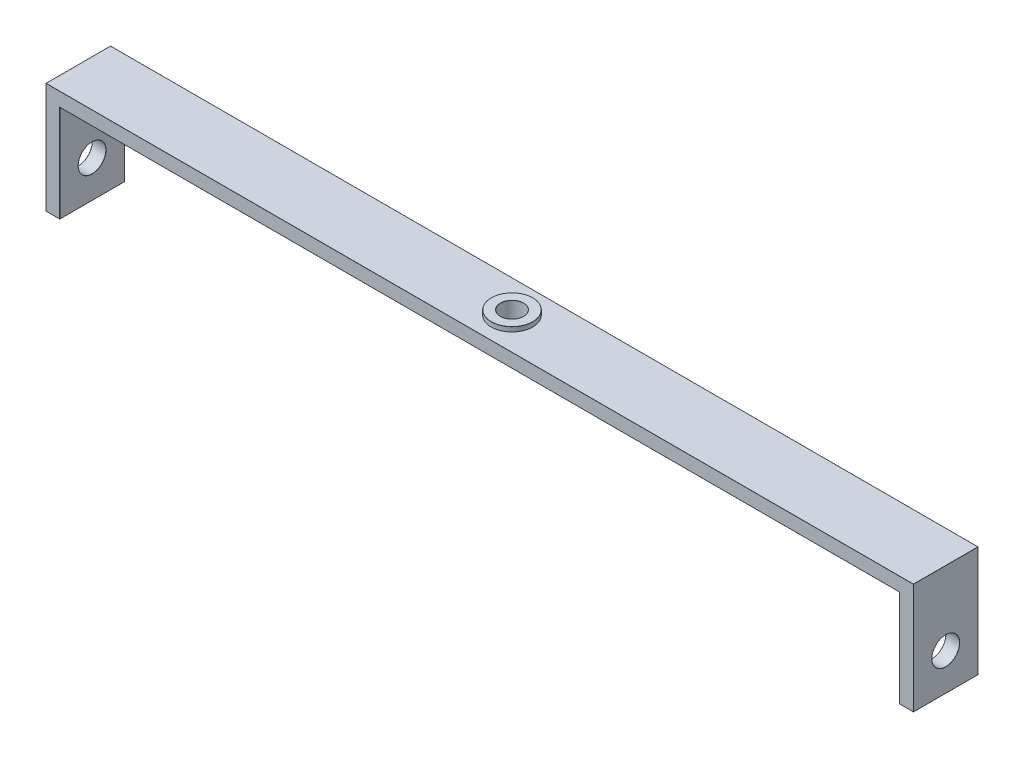
from build123d import *

# Parameters (mm, degrees)
BOSS_EXTRUDE1_DEPTH            = 3.5
BOSS_EXTRUDE1_DEPTH_BACK       = 3.5
SKETCH3_R                      = 1.25
CUT_EXTRUDE5_DEPTH             = 3.5
BOSS_EXTRUDE2_START            = 0.5
SKETCH5_R                      = 2.25
SKETCH5_R_2                    = 1.25
BOSS_EXTRUDE2_DEPTH            = 0.5
CUT_EXTRUDE6_REACH             = 72.102
SKETCH6_R                      = 1.5
CUT_EXTRUDE6_DIRECTION_2_REACH = 72.102
FILLET1_R                      = 0.01


with BuildPart() as part:
    # Sketch1 → Boss-Extrude1 (new, two sides: drawn at the far end of the back side and taken through both)
    with BuildSketch(Plane.XY.offset(-BOSS_EXTRUDE1_DEPTH_BACK)):
        Polygon((-62.621366216, 18.813688138), (-62.621366216, 30.813688138), (31.378633784, 30.813688138), (31.378633784, 18.813688138), (29.878633784, 18.813688138), (29.878633784, 29.313688138), (-61.121366216, 29.313688138), (-61.121366216, 18.813688138), align=None)
    extrude(amount=BOSS_EXTRUDE1_DEPTH + BOSS_EXTRUDE1_DEPTH_BACK)

    # Sketch3 → Cut-Extrude5 (cut)
    with BuildSketch(Plane(origin=(0, 30.813688138, 0), x_dir=(1, 0, 0), z_dir=(0, 1, 0))):
        with Locations((-15.621366216, 0)):
            Circle(SKETCH3_R)
    extrude(amount=-CUT_EXTRUDE5_DEPTH, mode=Mode.SUBTRACT)

    # Sketch5 → Boss-Extrude2 (add)
    with BuildSketch(Plane(origin=(0, 30.813688138, 0), x_dir=(1, 0, 0), z_dir=(0, 1, 0)).offset(BOSS_EXTRUDE2_START)):
        with Locations((-15.621366216, 0)):
            Circle(SKETCH5_R)
        with Locations((-15.621366216, 0)):
            Circle(SKETCH5_R_2, mode=Mode.SUBTRACT)
    extrude(amount=-BOSS_EXTRUDE2_DEPTH)

    # Cut-Extrude6: up to this face of the body (flat: up to its plane)
    cut_extrude6_end = Plane(part.part.faces().sort_by_distance((31.378633784, 24.813688138, 0))[0])
    # Sketch6 → Cut-Extrude6 (cut, up to the picked face)
    with BuildSketch(Plane(origin=(0, 0, 0), x_dir=(0, 0, -1), z_dir=(1, 0, 0)), mode=Mode.PRIVATE) as cut_extrude6_sk1:
        with Locations((0, 22.813688138)):
            Circle(SKETCH6_R)
    cut_extrude6_tool1 = split(extrude(cut_extrude6_sk1.sketch, amount=CUT_EXTRUDE6_REACH, mode=Mode.PRIVATE), bisect_by=cut_extrude6_end, keep=Keep.BOTH, mode=Mode.PRIVATE)
    add(cut_extrude6_tool1.solids().sort_by(Axis((0, 22.813688, 0), (1, 0, 0)))[0], mode=Mode.SUBTRACT)

    # Cut-Extrude6 direction 2: up to this face of the body (flat: up to its plane)
    cut_extrude6_direction_2_end = Plane(part.part.faces().sort_by_distance((-62.621366216, 24.813688138, 0))[0])
    # Sketch6 → Cut-Extrude6 direction 2 (cut, up to the picked face)
    with BuildSketch(Plane(origin=(0, 0, 0), x_dir=(0, 0, -1), z_dir=(1, 0, 0)), mode=Mode.PRIVATE) as cut_extrude6_direction_2_sk1:
        with Locations((0, 22.813688138)):
            Circle(SKETCH6_R)
    cut_extrude6_direction_2_tool1 = split(extrude(cut_extrude6_direction_2_sk1.sketch, amount=-CUT_EXTRUDE6_DIRECTION_2_REACH, mode=Mode.PRIVATE), bisect_by=cut_extrude6_direction_2_end, keep=Keep.BOTH, mode=Mode.PRIVATE)
    add(cut_extrude6_direction_2_tool1.solids().sort_by(Axis((0, 22.813688, 0), (-1, 0, 0)))[0], mode=Mode.SUBTRACT)

    # Fillet1
    fillet1_edges = [part.edges().sort_by_distance(p)[0] for p in [
        (-15.621366216, 29.313688138, -3.5),
        (31.378633784, 22.813688138, 1.5),
        (31.378633784, 24.813688138, -3.5),
        (31.378633784, 18.813688138, 0),
        (31.378633784, 24.813688138, 3.5),
        (31.378633784, 30.813688138, 0),
        (-61.121366216, 24.063688138, -3.5),
        (-61.121366216, 18.813688138, 0),
        (-61.121366216, 24.063688138, 3.5),
        (-61.121366216, 29.313688138, 0),
        (-62.621366216, 24.813688138, -3.5),
        (-62.621366216, 30.813688138, 0),
        (-62.621366216, 24.813688138, 3.5),
        (-62.621366216, 18.813688138, 0),
        (-16.871366216, 31.313688138, 0),
        (-17.871366216, 31.313688138, 0),
        (29.878633784, 24.063688138, -3.5),
        (29.878633784, 18.813688138, 0),
        (29.878633784, 22.813688138, 1.5),
        (29.878633784, 24.063688138, 3.5),
        (-61.871366216, 18.813688138, 3.5),
        (-15.621366216, 29.313688138, 3.5),
        (-15.621366216, 30.813688138, -3.5),
        (-15.621366216, 30.813688138, 3.5),
        (-61.121366216, 22.813688138, 1.5),
        (-61.871366216, 18.813688138, -3.5),
        (-62.621366216, 22.813688138, 1.5),
        (30.628633784, 18.813688138, -3.5),
        (30.628633784, 18.813688138, 3.5),
    ]]
    fillet(fillet1_edges, radius=FILLET1_R)


solid = part.part
